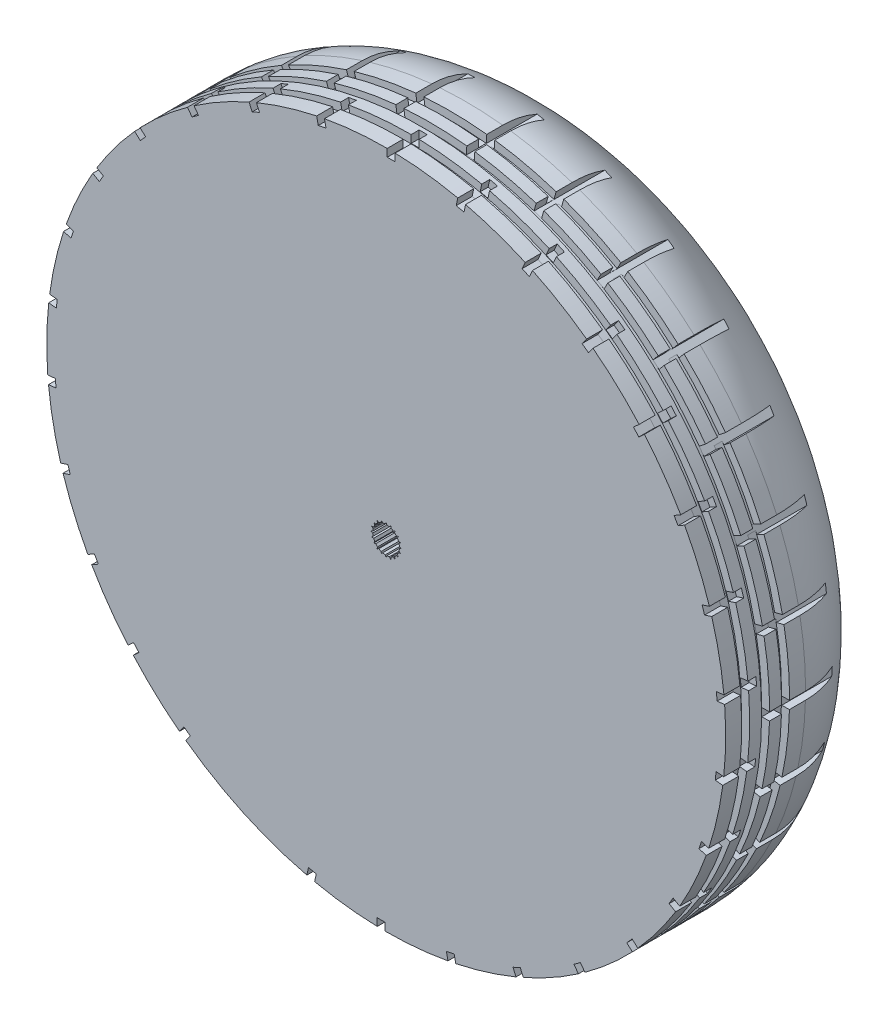
from build123d import *

# Parameters (mm, degrees)
SKETCH1_R           = 107.95
BOSS_EXTRUDE1_DEPTH = 25.4
CUT_EXTRUDE1_DEPTH  = 6
SKETCH6_R           = 107.95
SKETCH6_R_2         = 105.41
CUT_EXTRUDE2_DEPTH  = 1.27
LPATTERN1_COUNT     = 2
LPATTERN1_PITCH     = 6.35
LPATTERN1_COL_COUNT = 2
LPATTERN1_COL_PITCH = 6.35
CUT_EXTRUDE4_START  = 12.7
SKETCH9_W           = 2.54
SKETCH9_H           = 2.54
CUT_EXTRUDE4_DEPTH  = 10.16
CUT_EXTRUDE5_DEPTH  = 58.42


with BuildPart() as part:
    # Sketch1 → Boss-Extrude1 (new body)
    with BuildSketch(Plane.XY):
        Circle(SKETCH1_R)
    extrude(amount=BOSS_EXTRUDE1_DEPTH)

    # Sketch3 one side → Revolve1 (revolve)
    with BuildSketch(Plane(origin=(0, 0, 0), x_dir=(1, 0, 0), z_dir=(0, 1, 0)), mode=Mode.PRIVATE) as revolve1_sk:
        with BuildLine():
            Line((0, 0), (107.95, 0))
            add(Edge.make_bspline(
                [(107.95, 0), (107.95, 50.8), (0, 50.8)],
                knots=[0, 0, 0, 1.570796327, 1.570796327, 1.570796327], degree=2, weights=[1, 0.707106781, 1]))
            Line((0, 50.8), (0, 0))
        make_face()
    revolve(revolve1_sk.sketch.rotate(Axis((0, 0, -50.8), (0, 0, 1)), 180), axis=Axis((0, 0, -50.8), (0, 0, 1)))

    # Sketch5 → Cut-Extrude1 (cut)
    with BuildSketch(Plane.XY.offset(25.4)):
        with BuildLine():
            Line((-0.049025649, 4.825077363), (0.201728368, 4.207673552))
            ThreePointArc((0.201728368, 4.207673552), (0.615820828, 4.16275281), (1.023527432, 4.077513367))
            Line((1.023527432, 4.077513367), (1.452796944, 4.587212032))
            Line((1.452796944, 4.587212032), (1.500489916, 3.922538862))
            ThreePointArc((1.500489916, 3.922538862), (1.880433975, 3.75185509), (2.241845562, 3.544799293))
            Line((2.241845562, 3.544799293), (2.807610677, 3.896899955))
            Line((2.807610677, 3.896899955), (2.647574084, 3.250020267))
            ThreePointArc((2.647574084, 3.250020267), (2.956178171, 2.970281183), (3.235917255, 2.661677095))
            Line((3.235917255, 2.661677095), (3.882796944, 2.821713689))
            Line((3.882796944, 2.821713689), (3.530696282, 2.255948573))
            ThreePointArc((3.530696282, 2.255948573), (3.737752079, 1.894536987), (3.90843585, 1.514592927))
            Line((3.90843585, 1.514592927), (4.57310902, 1.466899955))
            Line((4.57310902, 1.466899955), (4.063410355, 1.037630444))
            ThreePointArc((4.063410355, 1.037630444), (4.148649799, 0.629923839), (4.19357054, 0.21583138))
            Line((4.19357054, 0.21583138), (4.810974351, -0.034922637))
            Line((4.810974351, -0.034922637), (4.19357054, -0.285676654))
            ThreePointArc((4.19357054, -0.285676654), (4.148649799, -0.699769114), (4.063410355, -1.107475718))
            Line((4.063410355, -1.107475718), (4.57310902, -1.53674523))
            Line((4.57310902, -1.53674523), (3.90843585, -1.584438202))
            ThreePointArc((3.90843585, -1.584438202), (3.737752079, -1.964382261), (3.530696282, -2.325793848))
            Line((3.530696282, -2.325793848), (3.882796944, -2.891558964))
            Line((3.882796944, -2.891558964), (3.235917255, -2.73152237))
            ThreePointArc((3.235917255, -2.73152237), (2.956178171, -3.040126457), (2.647574084, -3.319865541))
            Line((2.647574084, -3.319865541), (2.807610677, -3.96674523))
            Line((2.807610677, -3.96674523), (2.241845562, -3.614644568))
            ThreePointArc((2.241845562, -3.614644568), (1.880433975, -3.821700365), (1.500489916, -3.992384136))
            Line((1.500489916, -3.992384136), (1.452796944, -4.657057307))
            Line((1.452796944, -4.657057307), (1.023527432, -4.147358642))
            ThreePointArc((1.023527432, -4.147358642), (0.615820828, -4.232598085), (0.201728368, -4.277518826))
            Line((0.201728368, -4.277518826), (-0.049025649, -4.894922637))
            Line((-0.049025649, -4.894922637), (-0.299779666, -4.277518826))
            ThreePointArc((-0.299779666, -4.277518826), (-0.713872125, -4.232598085), (-1.12157873, -4.147358642))
            Line((-1.12157873, -4.147358642), (-1.550848241, -4.657057307))
            Line((-1.550848241, -4.657057307), (-1.598541213, -3.992384136))
            ThreePointArc((-1.598541213, -3.992384136), (-1.978485273, -3.821700365), (-2.339896859, -3.614644568))
            Line((-2.339896859, -3.614644568), (-2.905661975, -3.96674523))
            Line((-2.905661975, -3.96674523), (-2.745625381, -3.319865541))
            ThreePointArc((-2.745625381, -3.319865541), (-3.054229469, -3.040126457), (-3.333968553, -2.73152237))
            Line((-3.333968553, -2.73152237), (-3.980848241, -2.891558964))
            Line((-3.980848241, -2.891558964), (-3.628747579, -2.325793848))
            ThreePointArc((-3.628747579, -2.325793848), (-3.835803377, -1.964382261), (-4.006487148, -1.584438202))
            Line((-4.006487148, -1.584438202), (-4.671160318, -1.53674523))
            Line((-4.671160318, -1.53674523), (-4.161461653, -1.107475718))
            ThreePointArc((-4.161461653, -1.107475718), (-4.246701096, -0.699769114), (-4.291621838, -0.285676654))
            Line((-4.291621838, -0.285676654), (-4.909025649, -0.034922637))
            Line((-4.909025649, -0.034922637), (-4.291621838, 0.21583138))
            ThreePointArc((-4.291621838, 0.21583138), (-4.246701096, 0.629923839), (-4.161461653, 1.037630444))
            Line((-4.161461653, 1.037630444), (-4.671160318, 1.466899955))
            Line((-4.671160318, 1.466899955), (-4.006487148, 1.514592927))
            ThreePointArc((-4.006487148, 1.514592927), (-3.835803377, 1.894536987), (-3.628747579, 2.255948573))
            Line((-3.628747579, 2.255948573), (-3.980848241, 2.821713689))
            Line((-3.980848241, 2.821713689), (-3.333968553, 2.661677095))
            ThreePointArc((-3.333968553, 2.661677095), (-3.054229469, 2.970281183), (-2.745625381, 3.250020267))
            Line((-2.745625381, 3.250020267), (-2.905661975, 3.896899955))
            Line((-2.905661975, 3.896899955), (-2.339896859, 3.544799293))
            ThreePointArc((-2.339896859, 3.544799293), (-1.978485273, 3.75185509), (-1.598541213, 3.922538862))
            Line((-1.598541213, 3.922538862), (-1.550848241, 4.587212032))
            Line((-1.550848241, 4.587212032), (-1.12157873, 4.077513367))
            ThreePointArc((-1.12157873, 4.077513367), (-0.713872125, 4.16275281), (-0.299779666, 4.207673552))
            Line((-0.299779666, 4.207673552), (-0.049025649, 4.825077363))
        make_face()
    extrude(amount=-CUT_EXTRUDE1_DEPTH, mode=Mode.SUBTRACT)

    # Sketch6 → Cut-Extrude2 (cut, symmetric)
    with BuildSketch(Plane.XY.offset(12.7)):
        Circle(SKETCH6_R)
        Circle(SKETCH6_R_2, mode=Mode.SUBTRACT)
    cut_extrude2 = extrude(amount=CUT_EXTRUDE2_DEPTH, both=True, mode=Mode.SUBTRACT)

    # LPattern1: Cut-Extrude2 ×2
    with Locations(*[(0, 0, i * LPATTERN1_PITCH) for i in range(1, LPATTERN1_COUNT)]):
        add(cut_extrude2, mode=Mode.SUBTRACT)

    # LPattern1 col: Cut-Extrude2 ×2
    with Locations(*[(0, 0, -i * LPATTERN1_COL_PITCH) for i in range(1, LPATTERN1_COL_COUNT)]):
        add(cut_extrude2, mode=Mode.SUBTRACT)

    # Sketch9 → Cut-Extrude4 (cut)
    with BuildSketch(Plane.XY.offset(12.7).offset(CUT_EXTRUDE4_START)):
        Polygon((25.262447207, 105.094209741), (24.734351512, 102.609714835), (22.249856606, 103.13781053), (22.777952301, 105.622305436), align=None)
        with Locations((1.590087282, 106.780007222)):
            Rectangle(SKETCH9_W, SKETCH9_H)
        Polygon((46.560716967, 97.545290996), (45.527605893, 95.224885534), (43.207200431, 96.257996607), (44.240311504, 98.57840207), align=None)
        Polygon((65.824059972, 85.733174961), (64.331085431, 83.678271795), (62.276182265, 85.171246336), (63.769156806, 87.226149501), align=None)
        Polygon((82.210575697, 70.174107786), (80.32298784, 68.474516046), (78.6233961, 70.362103902), (80.510983957, 72.061695642), align=None)
        Polygon((95.004094774, 51.548095368), (92.804390249, 50.278095368), (91.534390249, 52.477799894), (93.734094774, 53.747799894), align=None)
        Polygon((103.64547903, 30.669183827), (101.229795478, 29.884280662), (100.444892313, 32.299964213), (102.860575864, 33.084867379), align=None)
        Polygon((107.757058505, 8.449881787), (105.230972891, 8.18437949), (104.965470595, 10.710465104), (107.491556209, 10.975967401), align=None)
        Polygon((107.159137449, -14.138720635), (104.633051834, -13.873218339), (104.898554131, -11.347132724), (107.424639745, -11.612635021), align=None)
        Polygon((101.877847879, -36.109393121), (99.462164327, -35.324489955), (100.247067493, -32.908806403), (102.662751045, -33.693709569), align=None)
        Polygon((92.144007493, -56.501911854), (89.944302967, -55.231911854), (91.214302967, -53.032207329), (93.414007493, -54.302207329), align=None)
        Polygon((78.383031823, -74.425025913), (76.495443966, -72.725434173), (78.195035706, -70.837846317), (80.082623563, -72.537438057), align=None)
        Polygon((61.196341539, -89.09540921), (59.703366998, -87.040506044), (61.758270164, -85.547531503), (63.251244705, -87.602434669), align=None)
        Polygon((41.335077477, -99.871895596), (40.301966404, -97.551490134), (42.622371866, -96.51837906), (43.655482939, -98.838784523), align=None)
        Polygon((19.667272182, -106.283500906), (19.139176487, -103.799006), (21.623671393, -103.270910306), (22.151767088, -105.755405212), align=None)
        with Locations((-1.590087282, -106.780007222)):
            Rectangle(SKETCH9_W, SKETCH9_H)
        Polygon((-25.262447207, -105.094209741), (-24.734351512, -102.609714835), (-22.249856606, -103.13781053), (-22.777952301, -105.622305436), align=None)
        Polygon((-65.824059972, -85.733174961), (-64.331085431, -83.678271795), (-62.276182265, -85.171246336), (-63.769156806, -87.226149501), align=None)
        Polygon((-82.210575697, -70.174107786), (-80.32298784, -68.474516046), (-78.6233961, -70.362103902), (-80.510983957, -72.061695642), align=None)
        Polygon((-95.004094774, -51.548095368), (-92.804390249, -50.278095368), (-91.534390249, -52.477799894), (-93.734094774, -53.747799894), align=None)
        Polygon((-103.64547903, -30.669183827), (-101.229795478, -29.884280662), (-100.444892313, -32.299964213), (-102.860575864, -33.084867379), align=None)
        Polygon((-107.757058505, -8.449881787), (-105.230972891, -8.18437949), (-104.965470595, -10.710465104), (-107.491556209, -10.975967401), align=None)
        Polygon((-107.159137449, 14.138720635), (-104.633051834, 13.873218339), (-104.898554131, 11.347132724), (-107.424639745, 11.612635021), align=None)
        Polygon((-101.877847879, 36.109393121), (-99.462164327, 35.324489955), (-100.247067493, 32.908806403), (-102.662751045, 33.693709569), align=None)
        Polygon((-92.144007493, 56.501911854), (-89.944302967, 55.231911854), (-91.214302967, 53.032207329), (-93.414007493, 54.302207329), align=None)
        Polygon((-78.383031823, 74.425025913), (-76.495443966, 72.725434173), (-78.195035706, 70.837846317), (-80.082623563, 72.537438057), align=None)
        Polygon((-61.196341539, 89.09540921), (-59.703366998, 87.040506044), (-61.758270164, 85.547531503), (-63.251244705, 87.602434669), align=None)
        Polygon((-41.335077477, 99.871895596), (-40.301966404, 97.551490134), (-42.622371866, 96.51837906), (-43.655482939, 98.838784523), align=None)
        Polygon((-19.667272182, 106.283500906), (-19.139176487, 103.799006), (-21.623671393, 103.270910306), (-22.151767088, 105.755405212), align=None)
    extrude(amount=-CUT_EXTRUDE4_DEPTH, mode=Mode.SUBTRACT)

    # Sketch11 → Cut-Extrude5 (cut)
    with BuildSketch(Plane.XY.offset(11.43)):
        Polygon((34.05388502, 103.701368427), (33.00225767, 100.029781054), (35.4573523, 99.326585297), (36.508979651, 102.998172669), align=None)
        Polygon((11.483718247, 104.705445533), (14.031365789, 104.528059166), (14.29664662, 108.338059166), (11.748999079, 108.515445533), align=None)
        Polygon((54.870452778, 94.355043906), (53.078440069, 90.982335147), (55.333682373, 89.784063028), (57.125695082, 93.156771787), align=None)
        Polygon((73.288918452, 80.8849512), (70.834839939, 77.958524612), (72.791665006, 76.317546374), (75.245743518, 79.243972962), align=None)
        Polygon((88.50430671, 63.879797999), (85.495417401, 61.527552466), (87.068302585, 59.515586731), (90.077191893, 61.867832264), align=None)
        Polygon((99.851632074, 44.082791095), (96.41943487, 42.407531034), (97.53963754, 40.11251036), (100.971834744, 41.787770421), align=None)
        Polygon((106.834961975, 22.359154688), (103.129460362, 21.434097003), (103.748022288, 18.956324805), (107.453523901, 19.88138249), align=None)
        Polygon((109.149091387, -0.34168407), (105.332233568, -0.47610992), (105.422120624, -3.028343106), (109.238978443, -2.893917256), align=None)
        Polygon((106.692881749, -23.027589595), (102.931482726, -22.365508554), (102.488766417, -24.880657892), (106.250165441, -25.542738932), align=None)
        Polygon((99.57368121, -44.707078956), (96.032132168, -43.277427144), (95.076161322, -45.645568537), (98.617710364, -47.075220349), align=None)
        Polygon((88.102632995, -64.432654438), (84.935716622, -62.297914498), (83.508271751, -64.415548806), (86.675188124, -66.550288745), align=None)
        Polygon((72.781076954, -81.342213738), (70.127202693, -78.595684051), (68.290669988, -80.370260491), (70.944544249, -83.116790179), align=None)
        Polygon((54.278638609, -94.696727976), (52.253793498, -91.458445067), (50.088438251, -92.812406134), (52.113283361, -96.050689043), align=None)
        Polygon((33.403963298, -103.912540795), (32.096642786, -100.324033167), (29.697101411, -101.198204266), (31.004421923, -104.786711894), align=None)
        Polygon((11.069374501, -108.586876954), (10.536714768, -104.804979609), (8.007858738, -105.161155268), (8.540518471, -108.943052613), align=None)
        Polygon((-11.748999079, -108.515445533), (-11.483718247, -104.705445533), (-14.031365789, -104.528059166), (-14.29664662, -108.338059166), align=None)
        Polygon((-34.05388502, -103.701368427), (-33.00225767, -100.029781054), (-35.4573523, -99.326585297), (-36.508979651, -102.998172669), align=None)
        Polygon((-54.870452778, -94.355043906), (-53.078440069, -90.982335147), (-55.333682373, -89.784063028), (-57.125695082, -93.156771787), align=None)
        Polygon((-73.288918452, -80.8849512), (-70.834839939, -77.958524612), (-72.791665006, -76.317546374), (-75.245743518, -79.243972962), align=None)
        Polygon((-88.50430671, -63.879797999), (-85.495417401, -61.527552466), (-87.068302585, -59.515586731), (-90.077191893, -61.867832264), align=None)
        Polygon((-99.851632074, -44.082791095), (-96.41943487, -42.407531034), (-97.53963754, -40.11251036), (-100.971834744, -41.787770421), align=None)
        Polygon((-106.834961975, -22.359154688), (-103.129460362, -21.434097003), (-103.748022288, -18.956324805), (-107.453523901, -19.88138249), align=None)
        Polygon((-109.149091387, 0.34168407), (-105.332233568, 0.47610992), (-105.422120624, 3.028343106), (-109.238978443, 2.893917256), align=None)
        Polygon((-106.692881749, 23.027589595), (-102.931482726, 22.365508554), (-102.488766417, 24.880657892), (-106.250165441, 25.542738932), align=None)
        Polygon((-99.57368121, 44.707078956), (-96.032132168, 43.277427144), (-95.076161322, 45.645568537), (-98.617710364, 47.075220349), align=None)
        Polygon((-88.102632995, 64.432654438), (-84.935716622, 62.297914498), (-83.508271751, 64.415548806), (-86.675188124, 66.550288745), align=None)
        Polygon((-72.781076954, 81.342213738), (-70.127202693, 78.595684051), (-68.290669988, 80.370260491), (-70.944544249, 83.116790179), align=None)
        Polygon((-54.278638609, 94.696727976), (-52.253793498, 91.458445067), (-50.088438251, 92.812406134), (-52.113283361, 96.050689043), align=None)
        Polygon((-33.403963298, 103.912540795), (-32.096642786, 100.324033167), (-29.697101411, 101.198204266), (-31.004421923, 104.786711894), align=None)
        Polygon((-11.069374501, 108.586876954), (-10.536714768, 104.804979609), (-8.007858738, 105.161155268), (-8.540518471, 108.943052613), align=None)
    extrude(amount=-CUT_EXTRUDE5_DEPTH, mode=Mode.SUBTRACT)


solid = part.part
